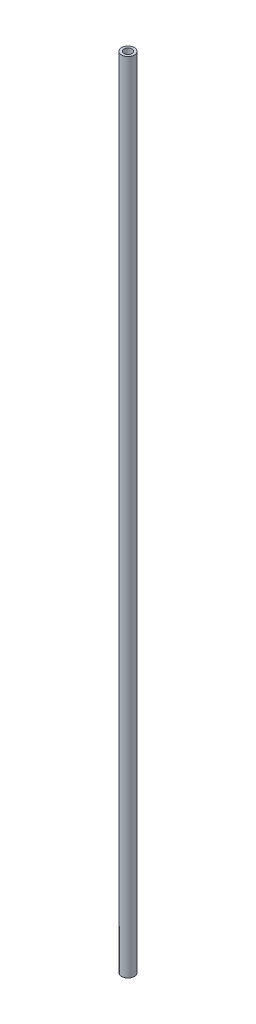
from build123d import *

# Parameters (mm, degrees)
SKETCH1_R           = 4
SKETCH1_R_2         = 2.5
BOSS_EXTRUDE1_DEPTH = 495


with BuildPart() as part:
    # Sketch1 → Boss-Extrude1 (new body)
    with BuildSketch(Plane(origin=(0, 0, 0), x_dir=(1, 0, 0), z_dir=(0, 1, 0))):
        with Locations(Location((0, 0, 0), (0, 0, 270))):
            Circle(SKETCH1_R)
        with Locations(Location((0, 0, 0), (0, 0, 270))):
            Circle(SKETCH1_R_2, mode=Mode.SUBTRACT)
    extrude(amount=BOSS_EXTRUDE1_DEPTH)


solid = part.part
